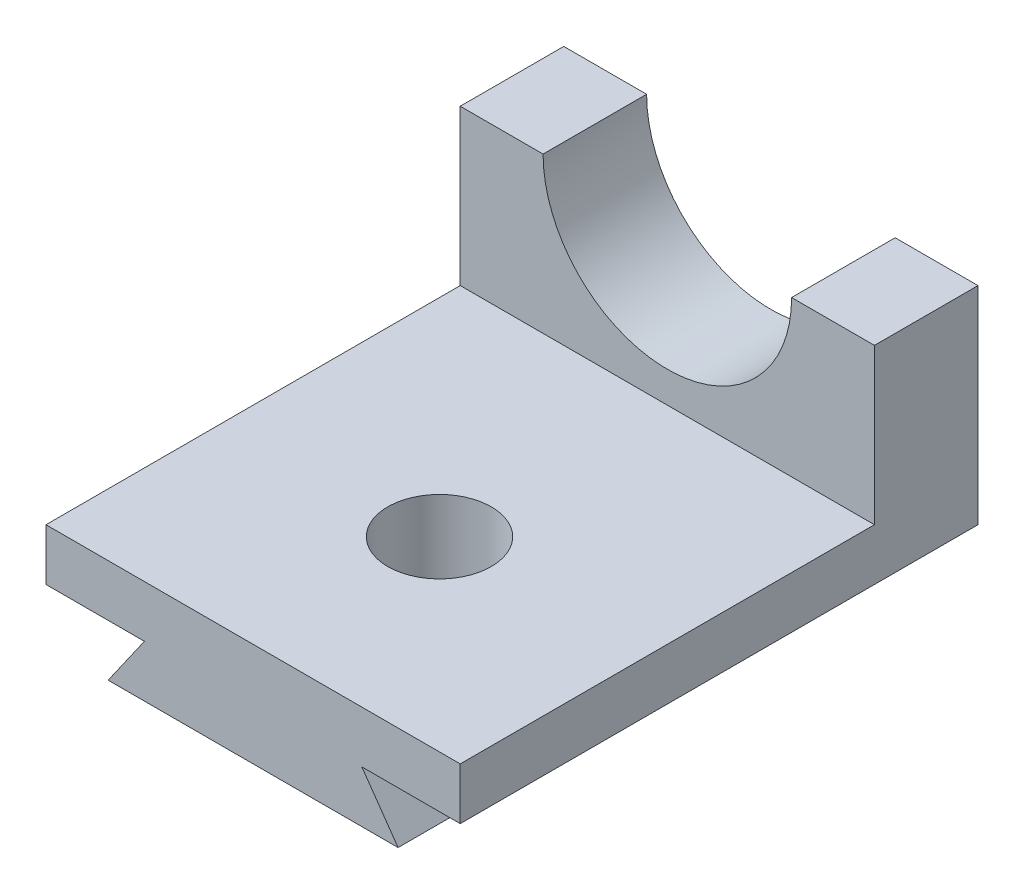
from build123d import *

# Parameters (mm, degrees)
EXTRUDE_1_DEPTH     = 50
SKETCH_2_R          = 5
CUT_EXTRUDE_1_DEPTH = 55.772255751
SKETCH_3_W          = 40
SKETCH_3_H          = 10
EXTRUDE_3_DEPTH     = 15
CUT_EXTRUDE_2_DEPTH = 48.16990566


with BuildPart() as part:
    # 草图1 → 凸台-拉伸1 (new body)
    with BuildSketch(Plane.XY):
        Polygon((-20, 0), (20, 0), (20, -5), (10.5, -5), (14, -10), (-14, -10), (-10.5, -5), (-20, -5), align=None)
    extrude(amount=EXTRUDE_1_DEPTH)

    # 草图2 → 切除-拉伸1 (cut, through all)
    with BuildSketch(Plane(origin=(0, 0, 0), x_dir=(1, 0, 0), z_dir=(0, 1, 0))):
        with Locations(Location((0, -32, 0), (0, 0, 270))):
            Circle(SKETCH_2_R)
    extrude(amount=-CUT_EXTRUDE_1_DEPTH, mode=Mode.SUBTRACT)

    # 草图3 → 凸台-拉伸3 (add)
    with BuildSketch(Plane(origin=(0, 0, 0), x_dir=(1, 0, 0), z_dir=(0, 1, 0))):
        with Locations((0, -5)):
            Rectangle(SKETCH_3_W, SKETCH_3_H)
    extrude(amount=EXTRUDE_3_DEPTH)

    # 草图4 → 切除-拉伸2 (cut, through all)
    with BuildSketch(Plane.XY.offset(10)):
        with BuildLine():
            Line((-12, 15), (12, 15))
            ThreePointArc((12, 15), (0, 3), (-12, 15))
        make_face()
    extrude(amount=-CUT_EXTRUDE_2_DEPTH, mode=Mode.SUBTRACT)


solid = part.part
